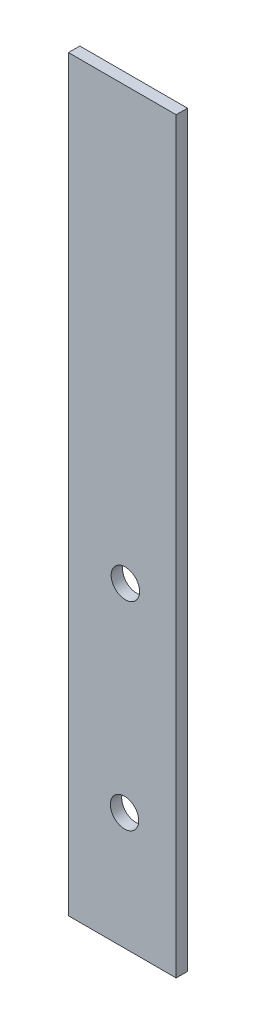
from build123d import *

# Parameters (mm, degrees)
SKETCH1_W           = 37.9
SKETCH1_H           = 263.090767789
SKETCH1_R           = 5
BOSS_EXTRUDE1_DEPTH = 4


with BuildPart() as part:
    # Sketch1 → Boss-Extrude1 (new body)
    with BuildSketch(Plane.XY):
        with Locations((-212.415418273, 67.048897724)):
            Rectangle(SKETCH1_W, SKETCH1_H)
        with Locations((-211.634282692, -23.173825437)):
            Circle(SKETCH1_R, mode=Mode.SUBTRACT)
        with Locations((-211.342423251, 46.826174563)):
            Circle(SKETCH1_R, mode=Mode.SUBTRACT)
    extrude(amount=BOSS_EXTRUDE1_DEPTH)


solid = part.part
